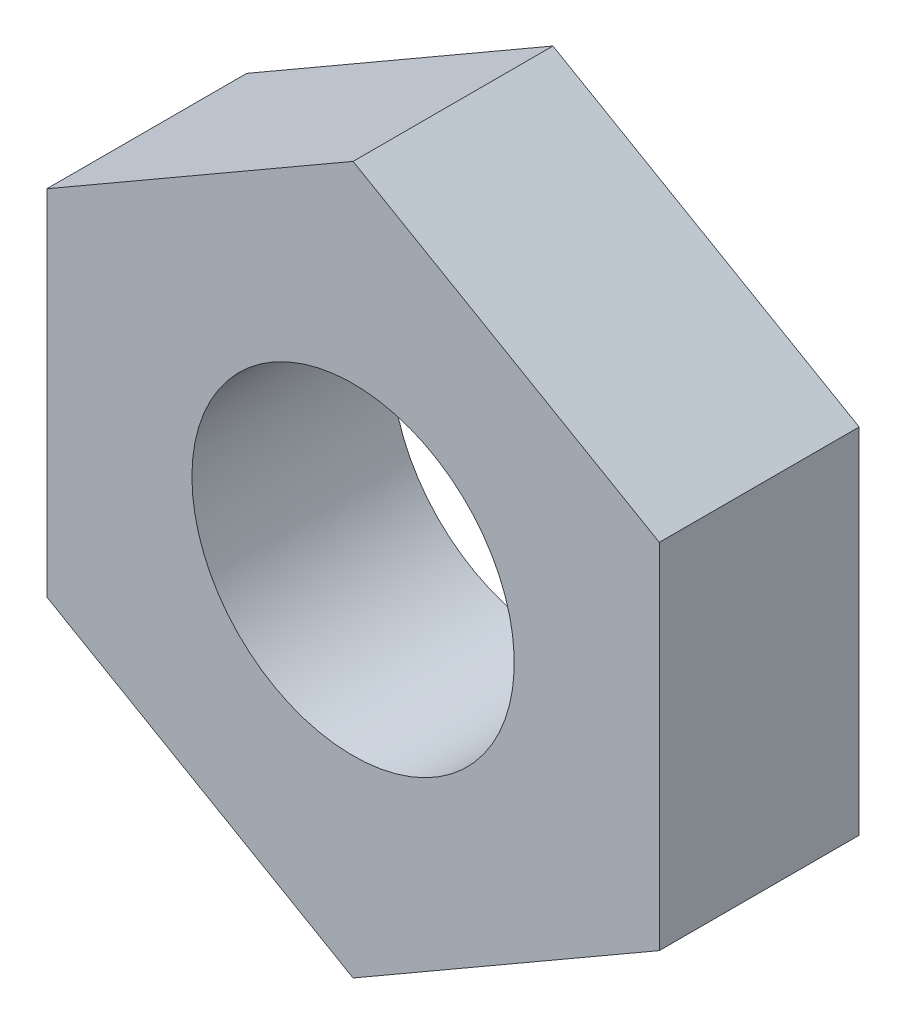
from build123d import *

# Parameters (mm, degrees)
SKETCH1_R           = 2.5
BOSS_EXTRUDE1_DEPTH = 3.1


with BuildPart() as part:
    # Sketch1 → Boss-Extrude1 (new body)
    with BuildSketch(Plane.XY):
        Polygon((20, -25.484827557), (24.75, -22.742413779), (24.75, -17.257586221), (20, -14.515172443), (15.25, -17.257586221), (15.25, -22.742413779), align=None)
        with Locations(Location((20, -20, 0), (0, 0, 180))):
            Circle(SKETCH1_R, mode=Mode.SUBTRACT)
    extrude(amount=BOSS_EXTRUDE1_DEPTH)


solid = part.part
